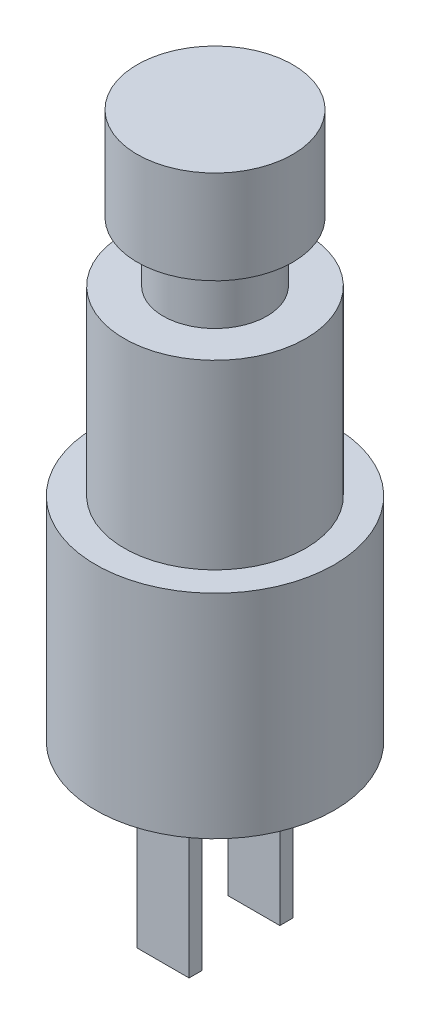
from build123d import *

# Parameters (mm, degrees)
SKETCH_2_W        = 2
SKETCH_2_H        = 0.5
EXTRUDE_795_DEPTH = 6.4


with BuildPart() as part:
    # Эскиз1 → Revolve 542 (revolve)
    with BuildSketch(Plane.XY):
        Polygon((0, 0), (0, 21.1), (3, 21.1), (3, 17.5), (2, 17.5), (2, 15.2), (3.5, 15.2), (3.5, 8.2), (4.6, 8.2), (4.6, 0), align=None)
    revolve(axis=Axis((0, 0, 0), (0, 1, 0)))

    # Эскиз2 → Extrude 795 (add)
    with BuildSketch(Plane.XZ):
        with Locations((0, 1.75)):
            Rectangle(SKETCH_2_W, SKETCH_2_H)
        with Locations((0, -1.75)):
            Rectangle(SKETCH_2_W, SKETCH_2_H)
    extrude(amount=EXTRUDE_795_DEPTH)


solid = part.part
